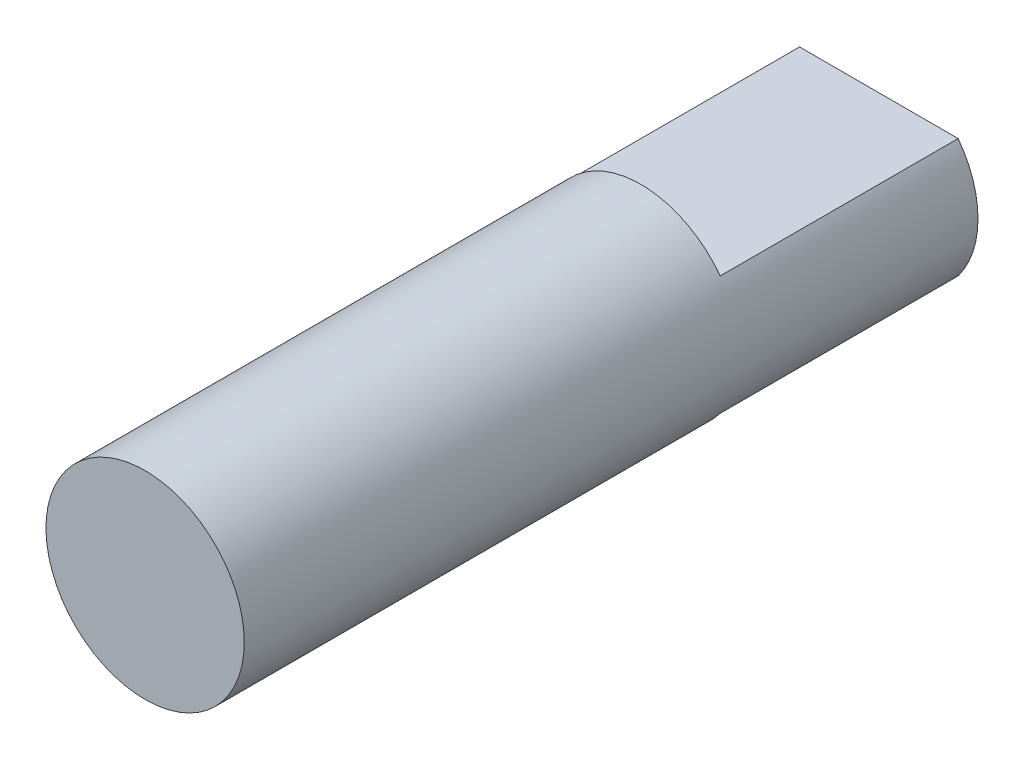
from build123d import *

# Parameters (mm, degrees)
ESQUISSE1_R             = 2.5
BOSS_EXTRU_1_DEPTH      = 18.5
ENL_V_MAT_EXTRU_1_DEPTH = 6


with BuildPart() as part:
    # Esquisse1 → Boss.-Extru.1 (new body)
    with BuildSketch(Plane.XY):
        Circle(ESQUISSE1_R)
    extrude(amount=BOSS_EXTRU_1_DEPTH)

    # Esquisse2 → Enlèv. mat.-Extru.1 (cut)
    with BuildSketch(Plane.XY):
        with BuildLine():
            Line((-2, 1.5), (2, 1.5))
            ThreePointArc((2, 1.5), (0, 2.5), (-2, 1.5))
        make_face()
        with BuildLine():
            Line((-2, -1.5), (2, -1.5))
            ThreePointArc((2, -1.5), (0, -2.5), (-2, -1.5))
        make_face()
    extrude(amount=ENL_V_MAT_EXTRU_1_DEPTH, mode=Mode.SUBTRACT)


solid = part.part
